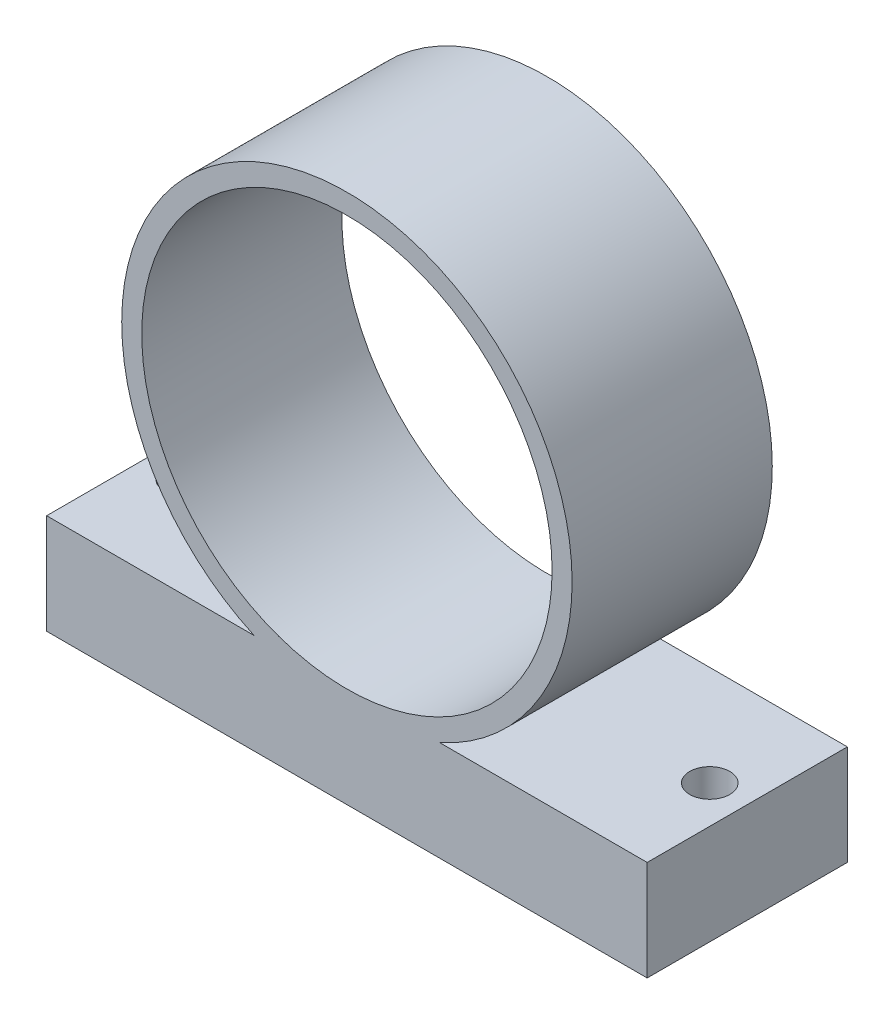
from build123d import *

# Parameters (mm, degrees)
SKETCH1_R           = 22.5
SKETCH1_R_2         = 20.5
BOSS_EXTRUDE2_DEPTH = 20
SKETCH2_W           = 60
SKETCH2_H           = 10
BOSS_EXTRUDE3_DEPTH = 20
SKETCH3_R           = 2
CUT_EXTRUDE1_DEPTH  = 20


with BuildPart() as part:
    # Sketch1 → Boss-Extrude2 (new body)
    with BuildSketch(Plane.XY):
        Circle(SKETCH1_R)
        Circle(SKETCH1_R_2, mode=Mode.SUBTRACT)
    extrude(amount=BOSS_EXTRUDE2_DEPTH)

    # Sketch2 → Boss-Extrude3 (add)
    with BuildSketch(Plane(origin=(0, 0, 0), x_dir=(-1, 0, 0), z_dir=(0, 0, -1))):
        with Locations((0, -25.5)):
            Rectangle(SKETCH2_W, SKETCH2_H)
    extrude(amount=-BOSS_EXTRUDE3_DEPTH)

    # Sketch3 → Cut-Extrude1 (cut)
    with BuildSketch(Plane(origin=(0, -20.5, 0), x_dir=(1, 0, 0), z_dir=(0, 1, 0))):
        with Locations(Location((26.25, -10, 0), (0, 0, 180))):
            Circle(SKETCH3_R)
        with Locations(Location((-26.25, -10, 0), (0, 0, 180))):
            Circle(SKETCH3_R)
    extrude(amount=-CUT_EXTRUDE1_DEPTH, mode=Mode.SUBTRACT)


solid = part.part
